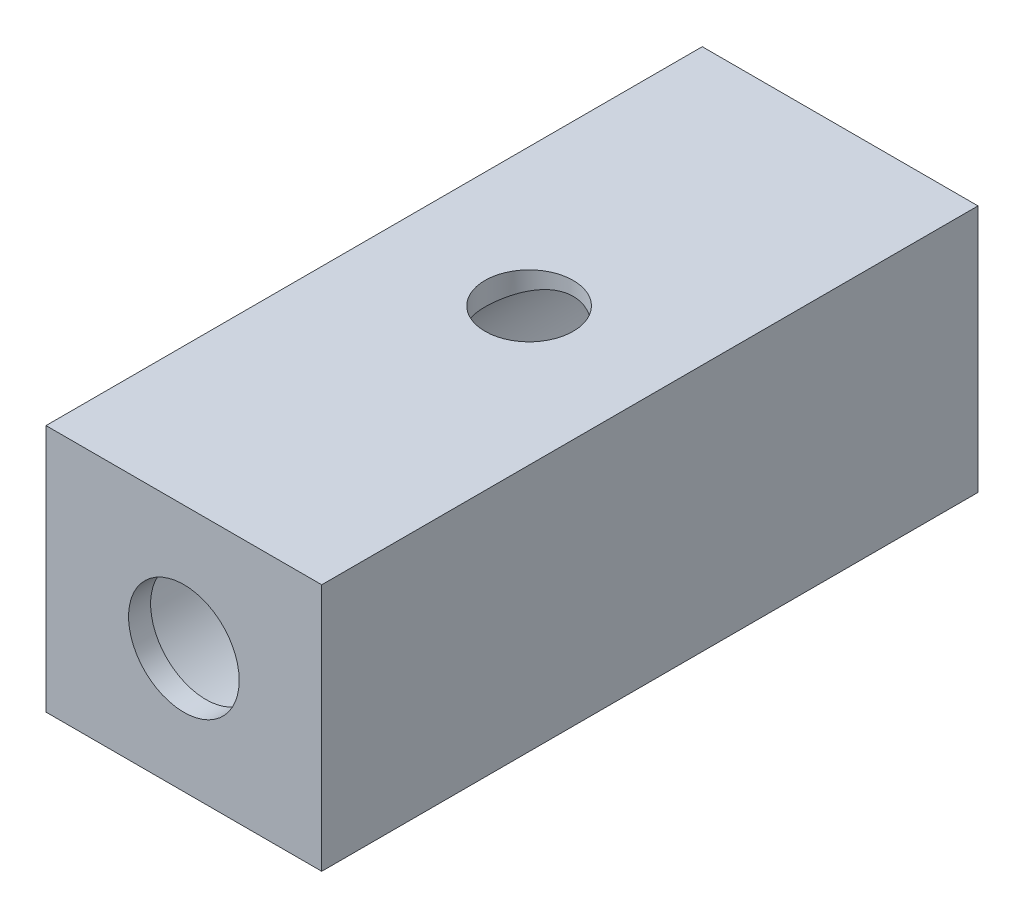
from build123d import *

# Parameters (mm, degrees)
SKETCH1_W               = 63.5
SKETCH1_H               = 57.15
BOSS_EXTRUDE5_DEPTH     = 148.59
SKETCH5_OUTSIDE_W       = 99.78
SKETCH5_OUTSIDE_H       = 93.43
SKETCH5_OUTSIDE_W_2     = 63.5
SKETCH5_OUTSIDE_H_2     = 57.15
SKETCH5_OUTSIDE_R       = 25.4
CUT_EXTRUDE4_DEPTH      = 146.05
SKETCH8_W               = 63.5
SKETCH8_H               = 57.15
SKETCH8_R               = 12.740402439
BOSS_EXTRUDE6_DEPTH     = 2.54
CUT_EXTRUDE5_REACH      = 175.605
CUT_EXTRUDE5_END_RADIUS = 25.4
SKETCH9_R               = 10.16
CUT_EXTRUDE6_REACH      = 175.605
CUT_EXTRUDE6_END_RADIUS = 25.4
SKETCH10_R              = 10.16


with BuildPart() as part:
    # Sketch1 → Boss-Extrude5 (new body)
    with BuildSketch(Plane.XY):
        with Locations((31.75, 28.575)):
            Rectangle(SKETCH1_W, SKETCH1_H)
    extrude(amount=BOSS_EXTRUDE5_DEPTH)

    # Sketch5 outside → Cut-Extrude4 (cut)
    # profile 1 of 2: a face of its own
    with BuildSketch(Plane.XY.offset(148.59)):
        with Locations((31.75, 28.575)):
            Rectangle(SKETCH5_OUTSIDE_W, SKETCH5_OUTSIDE_H)
        with Locations((31.75, 28.575)):
            Rectangle(SKETCH5_OUTSIDE_W_2, SKETCH5_OUTSIDE_H_2, mode=Mode.SUBTRACT)
    # profile 2 of 2: a face of its own
    with BuildSketch(Plane.XY.offset(148.59)):
        with Locations((31.75, 28.575)):
            Circle(SKETCH5_OUTSIDE_R)
    extrude(amount=-CUT_EXTRUDE4_DEPTH, mode=Mode.SUBTRACT)

    # Sketch8 → Boss-Extrude6 (add, symmetric)
    with BuildSketch(Plane.XY.offset(148.59)):
        with Locations((31.75, 28.575)):
            Rectangle(SKETCH8_W, SKETCH8_H)
        with Locations((31.75, 28.575)):
            Circle(SKETCH8_R, mode=Mode.SUBTRACT)
    extrude(amount=BOSS_EXTRUDE6_DEPTH, both=True)

    # Cut-Extrude5: up to this cylinder (the profile starts outside it)
    cut_extrude5_end = Plane(origin=(31.75, 28.575, 71.628), z_dir=(0, 0, 1)) * Cylinder(CUT_EXTRUDE5_END_RADIUS, 403.01, mode=Mode.PRIVATE)
    # Sketch9 → Cut-Extrude5 (cut, up to the surface)
    with BuildSketch(Plane(origin=(0, 57.15, 0), x_dir=(1, 0, 0), z_dir=(0, 1, 0)), mode=Mode.PRIVATE) as cut_extrude5_sk1:
        with Locations(Location((31.75, -71.628, 0), (0, 0, 270))):
            Circle(SKETCH9_R)
    cut_extrude5_tool1 = extrude(cut_extrude5_sk1.sketch, amount=-CUT_EXTRUDE5_REACH, mode=Mode.PRIVATE) - cut_extrude5_end
    add(cut_extrude5_tool1.solids().sort_by_distance((31.75, 57.15, 71.628))[0], mode=Mode.SUBTRACT)

    # Cut-Extrude6: up to this cylinder (the profile starts outside it)
    cut_extrude6_end = Plane(origin=(31.75, 28.575, 88.265), z_dir=(0, 0, 1)) * Cylinder(CUT_EXTRUDE6_END_RADIUS, 477.94, mode=Mode.PRIVATE)
    # Sketch10 → Cut-Extrude6 (cut, up to the surface)
    with BuildSketch(Plane.XZ, mode=Mode.PRIVATE) as cut_extrude6_sk1:
        with Locations(Location((17.78, 81.534, 0), (0, 0, 270))):
            Circle(SKETCH10_R)
    cut_extrude6_tool1 = extrude(cut_extrude6_sk1.sketch, amount=-CUT_EXTRUDE6_REACH, mode=Mode.PRIVATE) - cut_extrude6_end
    add(cut_extrude6_tool1.solids().sort_by_distance((17.78, 0, 81.534))[0], mode=Mode.SUBTRACT)
    # Sketch10 → Cut-Extrude6 (cut, up to the surface)
    with BuildSketch(Plane.XZ, mode=Mode.PRIVATE) as cut_extrude6_sk2:
        with Locations(Location((44.45, 125.73, 0), (0, 0, 270))):
            Circle(SKETCH10_R)
    cut_extrude6_tool2 = extrude(cut_extrude6_sk2.sketch, amount=-CUT_EXTRUDE6_REACH, mode=Mode.PRIVATE) - cut_extrude6_end
    add(cut_extrude6_tool2.solids().sort_by_distance((44.45, 0, 125.73))[0], mode=Mode.SUBTRACT)
    # Sketch10 → Cut-Extrude6 (cut, up to the surface)
    with BuildSketch(Plane.XZ, mode=Mode.PRIVATE) as cut_extrude6_sk3:
        with Locations(Location((44.45, 50.8, 0), (0, 0, 270))):
            Circle(SKETCH10_R)
    cut_extrude6_tool3 = extrude(cut_extrude6_sk3.sketch, amount=-CUT_EXTRUDE6_REACH, mode=Mode.PRIVATE) - cut_extrude6_end
    add(cut_extrude6_tool3.solids().sort_by_distance((44.45, 0, 50.8))[0], mode=Mode.SUBTRACT)


solid = part.part
